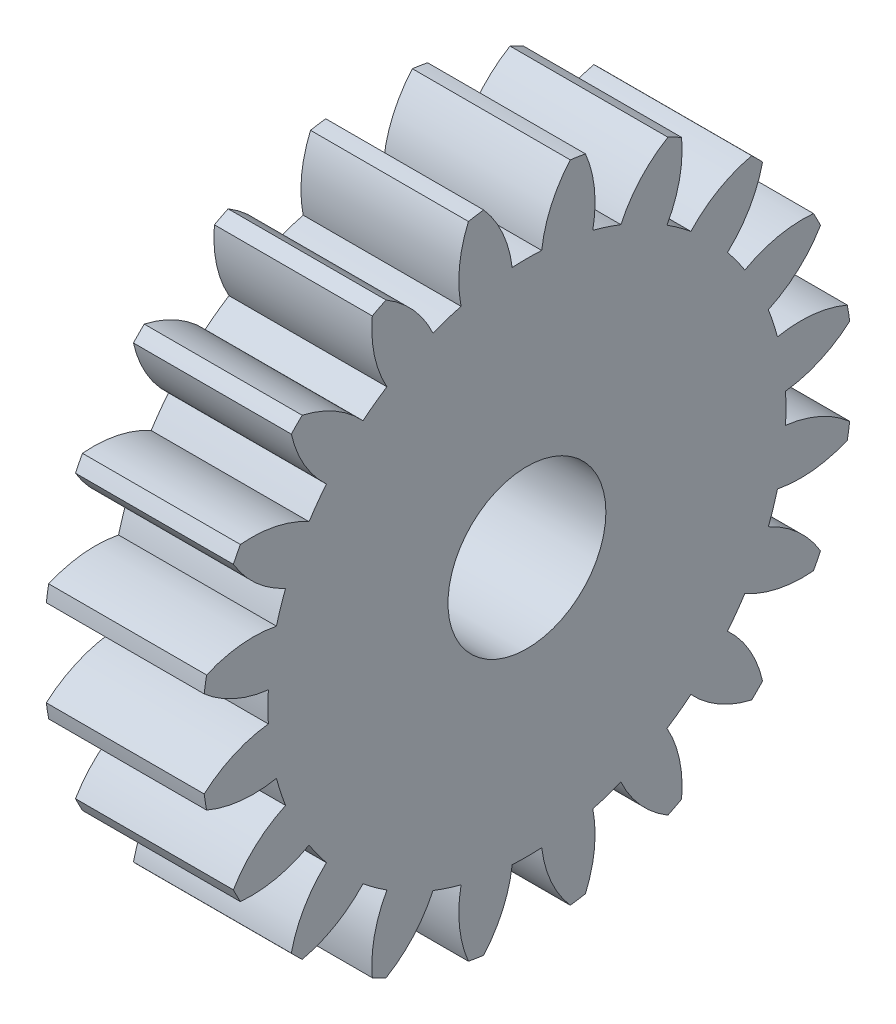
from build123d import *

# Parameters (mm, degrees)
BASPROSKE_W         = 6
BASPROSKE_H         = 12.375
TOOTHCUT_DEPTH      = 19.500844575
TEETHCUTS_COUNT     = 20
BORSKE_R            = 3
BORE_DEPTH          = 50.0000508
SKETCH1_R           = 3
BOSS_EXTRUDE1_DEPTH = 6
CUT_EXTRUDE1_DEPTH  = 6
SKETCH3_R           = 3
CUT_EXTRUDE2_DEPTH  = 6


with BuildPart() as part:
    # BasProSke → Base-Revolve (revolve)
    with BuildSketch(Plane(origin=(0, 0, 0), x_dir=(1, 0, 0), z_dir=(0, 1, 0)), mode=Mode.PRIVATE) as base_revolve_sk:
        with Locations((3, 6.1875)):
            Rectangle(BASPROSKE_W, BASPROSKE_H)
    revolve(base_revolve_sk.sketch.rotate(Axis((-10, 0, 0), (1, 0, 0)), 180), axis=Axis((-10, 0, 0), (1, 0, 0)))

    # TooCutSke → ToothCut (cut, through all)
    with BuildSketch(Plane(origin=(0, 0, 0), x_dir=(0, 0, -1), z_dir=(1, 0, 0))):
        with BuildLine():
            ThreePointArc((0.561279811, 9.826733564), (0, 9.84275), (-0.561279811, 9.826733564))
            ThreePointArc((-0.561279811, 9.826733564), (-0.925277854, 11.14210546), (-1.666860651, 12.287859689))
            ThreePointArc((-1.666860651, 12.287859689), (0, 12.4004), (1.666860651, 12.287859689))
            ThreePointArc((1.666860651, 12.287859689), (0.925277854, 11.14210546), (0.561279811, 9.826733564))
        make_face()
    toothcut = extrude(amount=TOOTHCUT_DEPTH, mode=Mode.SUBTRACT)

    # TeethCuts: ToothCut ×20 about axis
    teethcuts_axis = Axis((0, 0, 0), (1, 0, 0))
    for i in range(1, TEETHCUTS_COUNT):
        add(toothcut.rotate(teethcuts_axis, i * 360 / TEETHCUTS_COUNT), mode=Mode.SUBTRACT)

    # BorSke → Bore (cut, symmetric)
    with BuildSketch(Plane(origin=(0, 0, 0), x_dir=(0, 0, -1), z_dir=(1, 0, 0))):
        with Locations(Location((0, 0, 0), (0, 0, 180))):
            Circle(BORSKE_R)
    extrude(amount=BORE_DEPTH, both=True, mode=Mode.SUBTRACT)

    # Sketch1 → Boss-Extrude1 (add)
    with BuildSketch(Plane(origin=(6, 0, 0), x_dir=(0, 0, -1), z_dir=(1, 0, 0))):
        Circle(SKETCH1_R)
    extrude(amount=-BOSS_EXTRUDE1_DEPTH)

    # Sketch2 → Cut-Extrude1 (cut)
    with BuildSketch(Plane(origin=(6, 0, 0), x_dir=(0, 0, -1), z_dir=(1, 0, 0))):
        with BuildLine():
            ThreePointArc((1.8, 2.01246118), (0, 2.7), (-1.8, 2.01246118))
            Line((-1.8, 2.01246118), (-1.8, 0))
            Line((-1.8, 0), (1.8, 0))
            Line((1.8, 0), (1.8, 2.01246118))
        make_face()
        with BuildLine():
            Line((1.8, 0), (-1.8, 0))
            Line((-1.8, 0), (-1.8, -2.01246118))
            ThreePointArc((-1.8, -2.01246118), (0, -2.7), (1.8, -2.01246118))
            Line((1.8, -2.01246118), (1.8, 0))
        make_face()
    extrude(amount=-CUT_EXTRUDE1_DEPTH, mode=Mode.SUBTRACT)

    # Sketch3 → Cut-Extrude2 (cut)
    with BuildSketch(Plane(origin=(6, 0, 0), x_dir=(0, 0, -1), z_dir=(1, 0, 0))):
        Circle(SKETCH3_R)
    extrude(amount=-CUT_EXTRUDE2_DEPTH, mode=Mode.SUBTRACT)


solid = part.part
